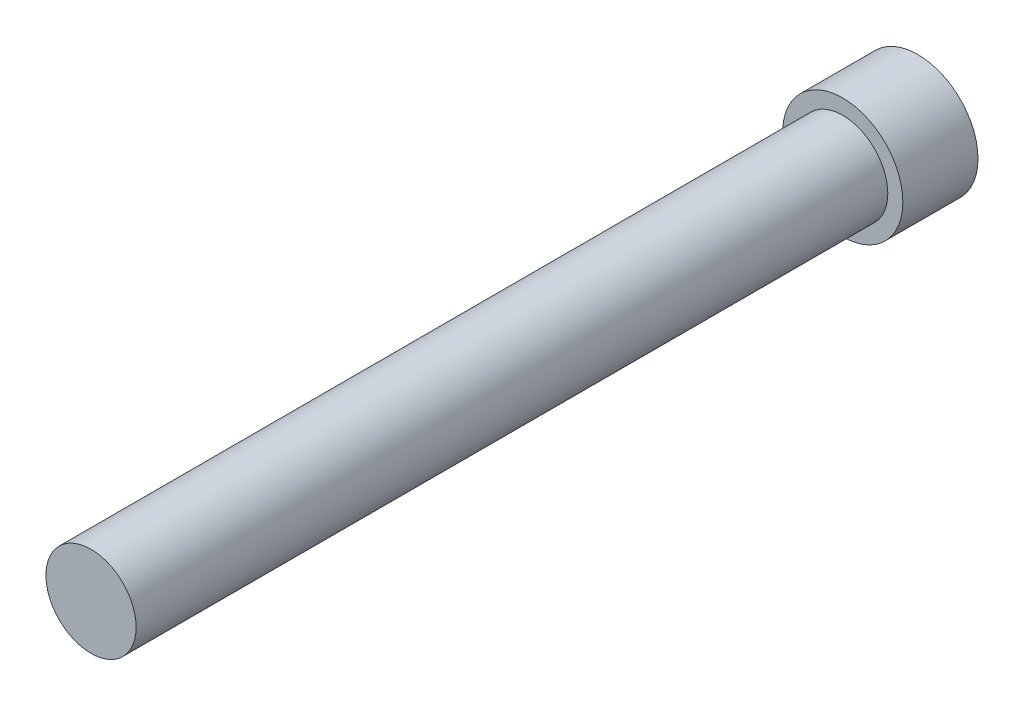
from build123d import *

# Parameters (mm, degrees)
SKETCH_1_R      = 2
EXTRUDE_1_DEPTH = 2.5
SKETCH_2_R      = 1.5
EXTRUDE_2_DEPTH = 25


with BuildPart() as part:
    # 草图1 → 凸台-拉伸1 (new body)
    with BuildSketch(Plane.XY):
        Circle(SKETCH_1_R)
        Polygon((-0.956343023, 1.081083417), (-1.414417215, -0.287675644), (-0.458074192, -1.368759061), (0.956343023, -1.081083417), (1.414417215, 0.287675644), (0.458074192, 1.368759061), align=None, mode=Mode.SUBTRACT)
    extrude(amount=EXTRUDE_1_DEPTH)

    # 草图2 → 凸台-拉伸2 (add)
    with BuildSketch(Plane.XY.offset(2.5)):
        Circle(SKETCH_2_R)
    extrude(amount=EXTRUDE_2_DEPTH)


solid = part.part
